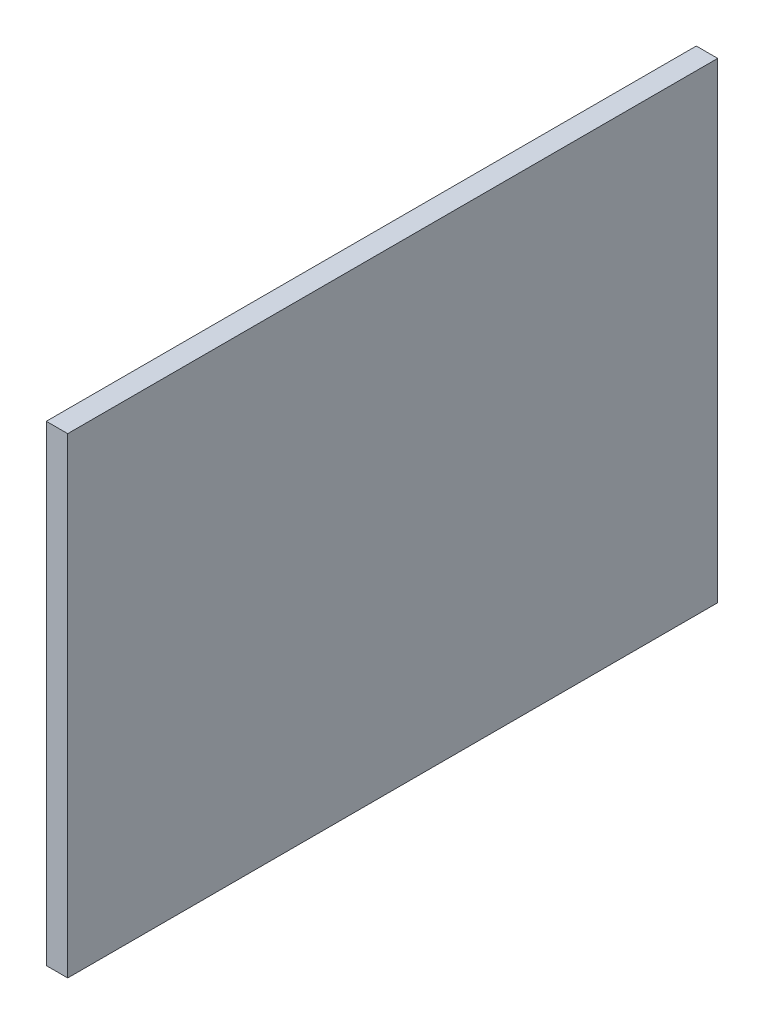
from build123d import *

# Parameters (mm, degrees)
SKETCH1_W           = 577.85
SKETCH1_H           = 419.1
BOSS_EXTRUDE1_DEPTH = 19.05


with BuildPart() as part:
    # Sketch1 → Boss-Extrude1 (new body)
    with BuildSketch(Plane(origin=(0, 0, 0), x_dir=(0, 0, -1), z_dir=(1, 0, 0))):
        with Locations((288.925, 209.55)):
            Rectangle(SKETCH1_W, SKETCH1_H)
    extrude(amount=BOSS_EXTRUDE1_DEPTH)


solid = part.part
